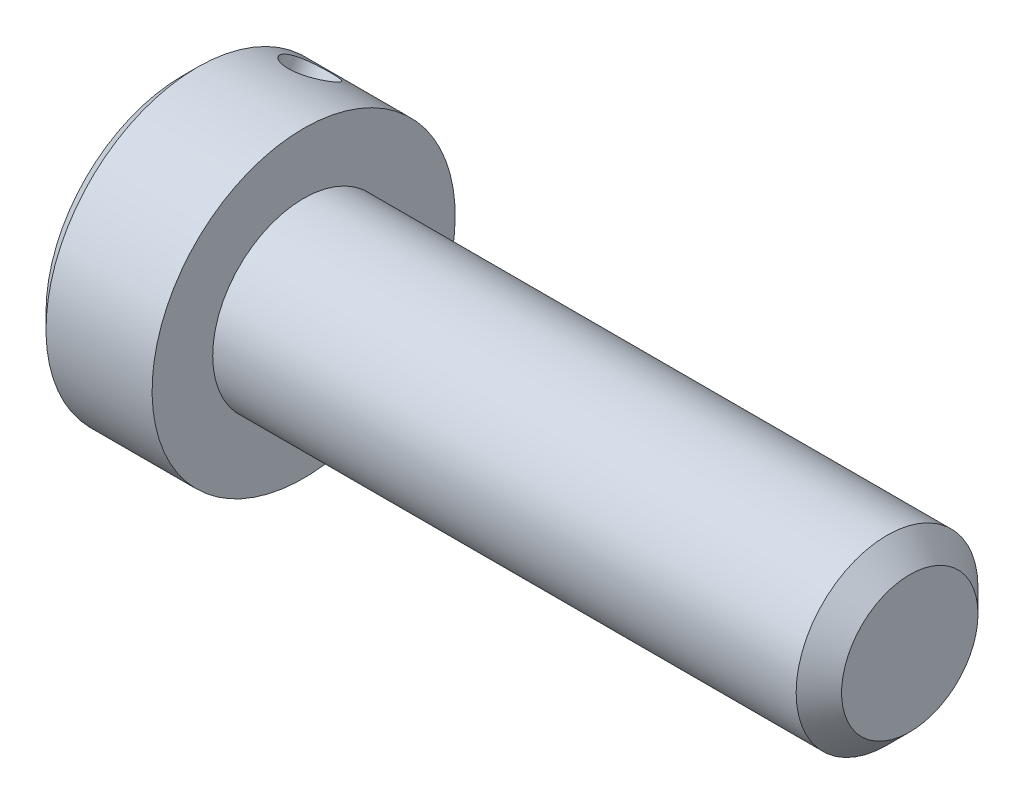
from build123d import *

# Parameters (mm, degrees)
SKETCH2_R               = 3
BOSS_EXTRUDE1_DEPTH     = 20
CHAMFER1_SIZE           = 0.75
CUT_EXTRUDE1_DEPTH      = 3.12
CUT_EXTRUDE3_DEPTH      = 17.652942925
CUT_EXTRUDE3_DEPTH_BACK = 17.652942925
SKETCH9_R               = 0.79375


with BuildPart() as part:
    # Sketch2 → Boss-Extrude1 (new body)
    with BuildSketch(Plane(origin=(10, 0, 0), x_dir=(0, 0, -1), z_dir=(1, 0, 0))):
        Circle(SKETCH2_R)
    extrude(amount=-BOSS_EXTRUDE1_DEPTH)

    # Chamfer1
    chamfer1_edges = [part.edges().sort_by_distance(p)[0] for p in [
        (10, 0, 3),
    ]]
    chamfer(chamfer1_edges, length=CHAMFER1_SIZE)

    # Sketch6 → Revolve1 (revolve)
    with BuildSketch(Plane.XY):
        Polygon((-13.5, 5), (-14, 4.5), (-14, 0), (-10, 0), (-10, 5), align=None)
    revolve(axis=Axis((-10, 0, 0), (-1, 0, 0)))

    # Sketch4 → Cut-Extrude1 (cut)
    with BuildSketch(Plane(origin=(-14, 0, 0), x_dir=(0, 0, -1), z_dir=(1, 0, 0))):
        Polygon((0, 2.309401077), (-2, 1.154700538), (-2, -1.154700538), (0, -2.309401077), (2, -1.154700538), (2, 1.154700538), align=None)
    extrude(amount=CUT_EXTRUDE1_DEPTH, mode=Mode.SUBTRACT)

    # Cut-Extrude2 cone 1 section (through the dimple's axis) → Cut-Extrude2 (revolve, cut)
    with BuildSketch(Plane(origin=(-14, 0, 0), x_dir=(0, 0, 1), z_dir=(0, 1, 0))):
        Polygon((0, 0), (2.309401077, 0), (0, 2.309401077), align=None)
    revolve(axis=Axis((-14, 0, 0), (1, 0, 0)), mode=Mode.SUBTRACT)

    # Sketch9 → Cut-Extrude3 (cut, two sides: drawn at the far end of the back side and taken through both)
    with BuildSketch(Plane(origin=(0, -1.732050808, 1), x_dir=(1, 0, 0), z_dir=(0, 0.8660254037844387, -0.49999999999999983)).offset(-CUT_EXTRUDE3_DEPTH_BACK)):
        with Locations(Location((-12.285299496, 0, 0), (0, 0, 270))):
            Circle(SKETCH9_R)
    extrude(amount=CUT_EXTRUDE3_DEPTH + CUT_EXTRUDE3_DEPTH_BACK, mode=Mode.SUBTRACT)


solid = part.part
